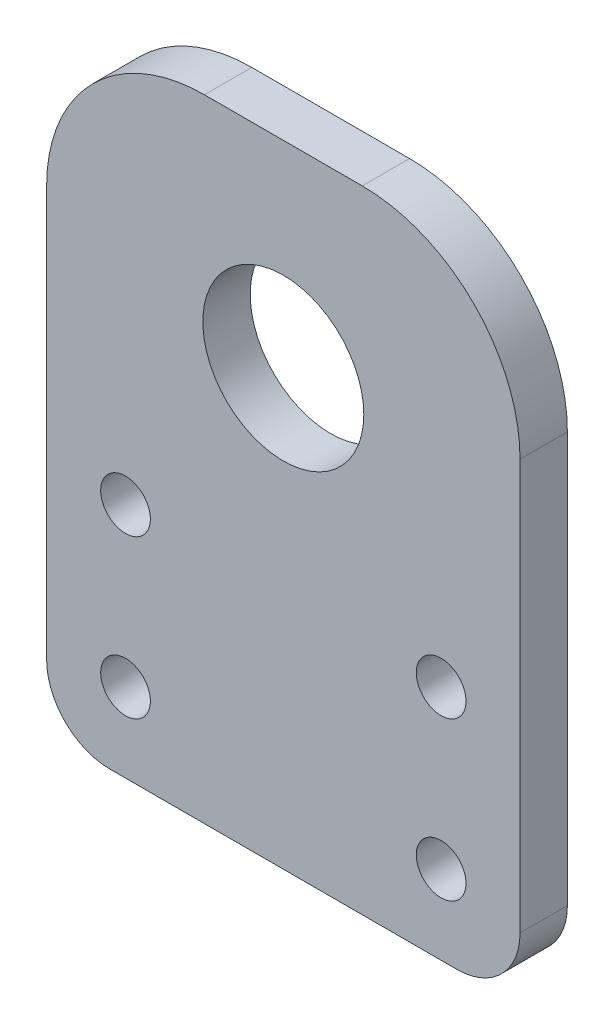
from build123d import *

# Parameters (mm, degrees)
SKETCH_1_W          = 30
SKETCH_1_H          = 40
EXTRUDE_1_DEPTH     = 3
SKETCH_2_R          = 5.1
SKETCH_2_R_2        = 1.575
CUT_EXTRUDE_1_DEPTH = 51.089919145
FILLET_1_R          = 10
FILLET_2_R          = 4


with BuildPart() as part:
    # 草图1 → 凸台-拉伸1 (new body)
    with BuildSketch(Plane.XY):
        with Locations((15, -20)):
            Rectangle(SKETCH_1_W, SKETCH_1_H)
    extrude(amount=EXTRUDE_1_DEPTH)

    # 草图2 → 切除-拉伸1 (cut, through all)
    with BuildSketch(Plane.XY.offset(3)):
        with Locations((15, -12.5)):
            Circle(SKETCH_2_R)
        with Locations((5, -25)):
            Circle(SKETCH_2_R_2)
        with Locations(Location((5, -35, 0), (0, 0, 180))):
            Circle(SKETCH_2_R_2)
        with Locations((25, -35)):
            Circle(SKETCH_2_R_2)
        with Locations(Location((25, -25, 0), (0, 0, 180))):
            Circle(SKETCH_2_R_2)
    extrude(amount=-CUT_EXTRUDE_1_DEPTH, mode=Mode.SUBTRACT)

    # 圆角1
    fillet_1_edges = [part.edges().sort_by_distance(p)[0] for p in [
        (0, 0, 1.5),
        (30, 0, 1.5),
    ]]
    fillet(fillet_1_edges, radius=FILLET_1_R)

    # 圆角2
    fillet_2_edges = [part.edges().sort_by_distance(p)[0] for p in [
        (30, -40, 1.5),
        (0, -40, 1.5),
    ]]
    fillet(fillet_2_edges, radius=FILLET_2_R)


solid = part.part
